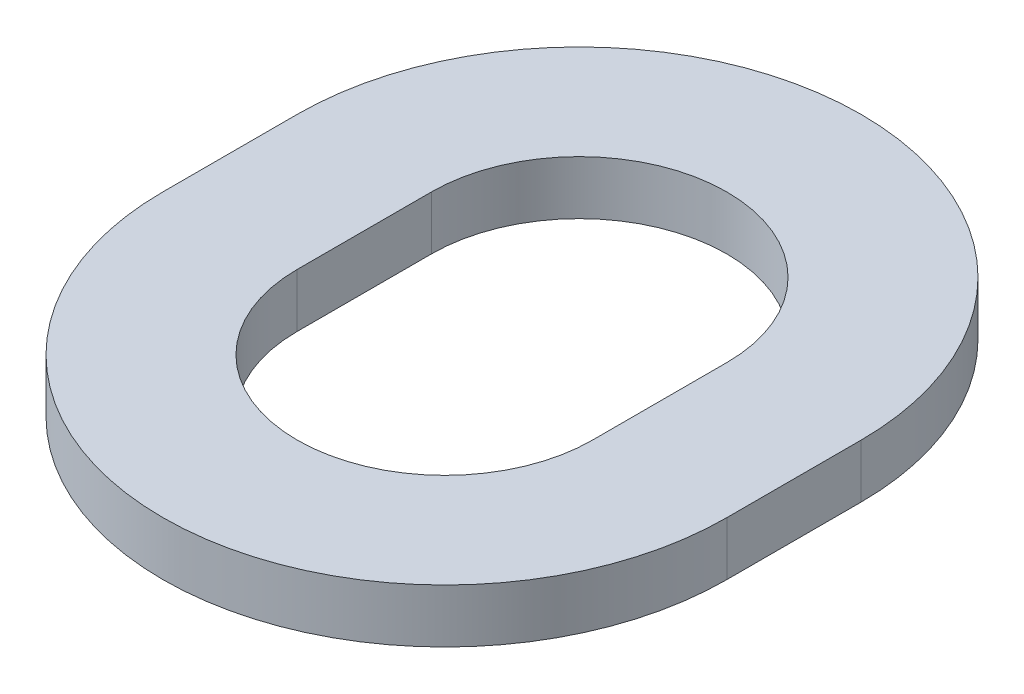
from build123d import *

# Parameters (mm, degrees)
EXTRUDE_2_DEPTH = 4


with BuildPart() as part:
    # 草图1 → 凸台-拉伸2 (new body)
    with BuildSketch(Plane(origin=(0, 0, 0), x_dir=(1, 0, 0), z_dir=(0, 1, 0))):
        with BuildLine():
            Line((-21, 0), (-21, -10))
            ThreePointArc((-21, -10), (0, -31), (21, -10))
            Line((21, -10), (21, 0))
            ThreePointArc((21, 0), (0, 21), (-21, 0))
        make_face()
        with BuildLine():
            Line((11, 0), (11, -10))
            ThreePointArc((11, -10), (0, -21), (-11, -10))
            Line((-11, -10), (-11, 0))
            ThreePointArc((-11, 0), (0, 11), (11, 0))
        make_face(mode=Mode.SUBTRACT)
    extrude(amount=EXTRUDE_2_DEPTH)


solid = part.part
